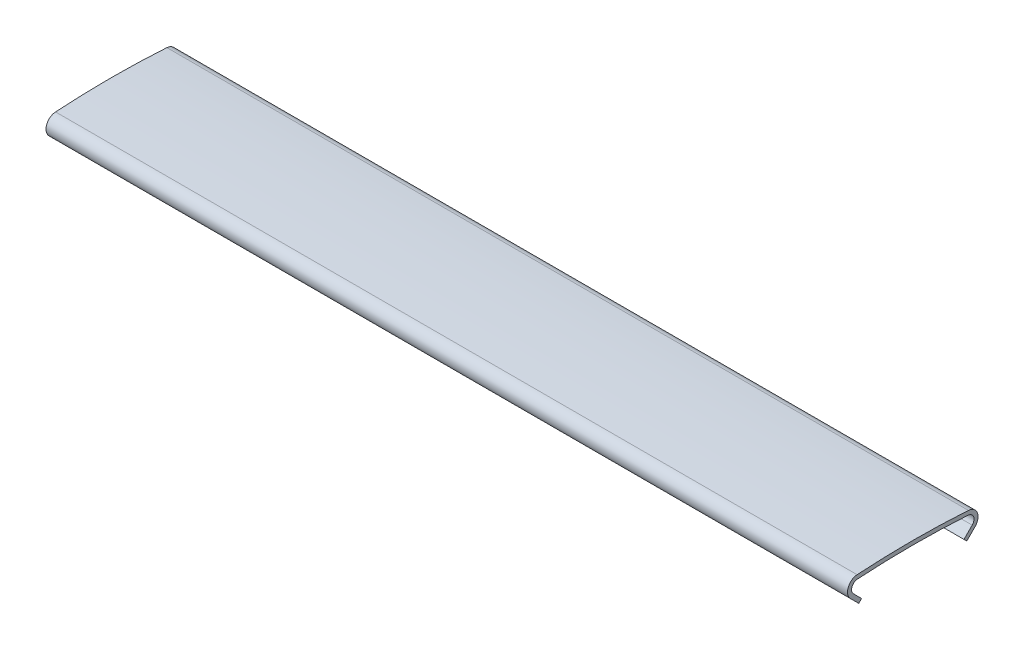
from build123d import *

# Parameters (mm, degrees)
BOSS_EXTRUDE1_DEPTH = 43


with BuildPart() as part:
    # Sketch1 → Boss-Extrude1 (new, symmetric)
    with BuildSketch(Plane(origin=(0, 0, 0), x_dir=(0, 0, -1), z_dir=(1, 0, 0))):
        with BuildLine():
            Line((6.678248915, -2.066776115), (5.793546079, -2.951478951))
            Line((5.793546079, -2.951478951), (5.489490163, -2.647423035))
            Line((5.489490163, -2.647423035), (6.374192999, -1.762720199))
            ThreePointArc((6.374192999, -1.762720199), (6.527082765, -1.0543294), (5.944808192, -0.622879372))
            ThreePointArc((5.944808192, -0.622879372), (0, -0.43), (-5.944808192, -0.622879372))
            ThreePointArc((-5.944808192, -0.622879372), (-6.527082765, -1.0543294), (-6.374192999, -1.762720199))
            Line((-6.374192999, -1.762720199), (-5.489490163, -2.647423035))
            Line((-5.489490163, -2.647423035), (-5.793546079, -2.951478951))
            Line((-5.793546079, -2.951478951), (-6.678248915, -2.066776115))
            ThreePointArc((-6.678248915, -2.066776115), (-6.929478176, -0.902744659), (-5.97268156, -0.193783724))
            ThreePointArc((-5.97268156, -0.193783724), (0, 0), (5.97268156, -0.193783724))
            ThreePointArc((5.97268156, -0.193783724), (6.929478176, -0.902744659), (6.678248915, -2.066776115))
        make_face()
    extrude(amount=BOSS_EXTRUDE1_DEPTH, both=True)


solid = part.part
